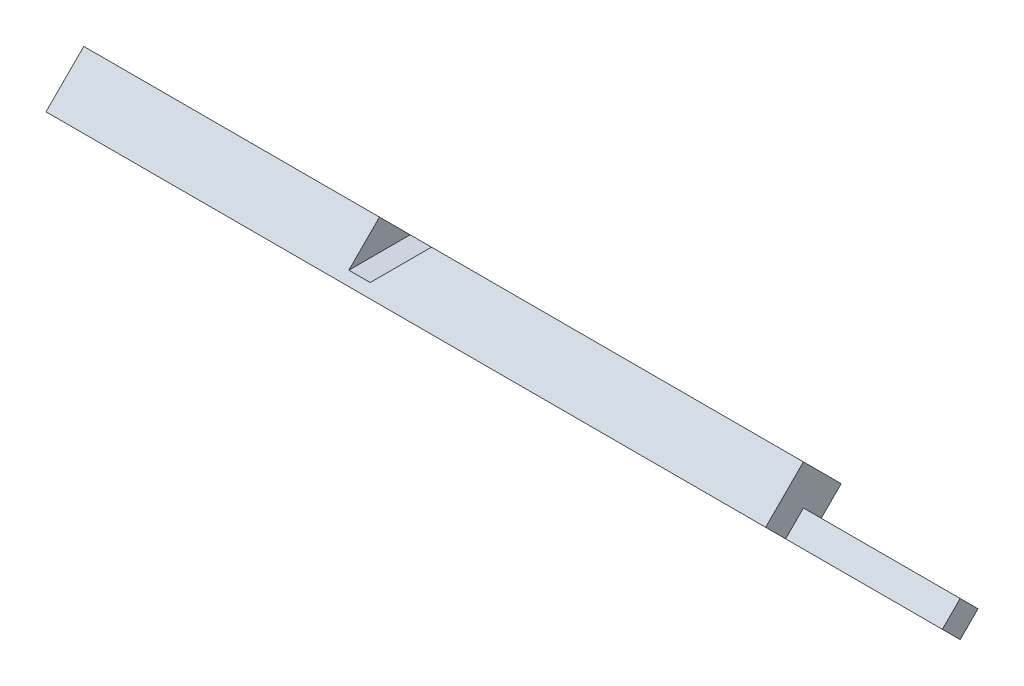
from build123d import *

# Parameters (mm, degrees)
BOSS_EXTRUDE1_DEPTH     = 101
BOSS_EXTRUDE2_DEPTH     = 22
CUT_EXTRUDE1_REACH      = 126.228
CUT_EXTRUDE1_START      = 1
SKETCH3_W               = 3
SKETCH3_H               = 10.606601718
CUT_EXTRUDE2_DEPTH      = 124.228446391
CUT_EXTRUDE2_DEPTH_BACK = 124.228446391


with BuildPart() as part:
    # Sketch1 → Boss-Extrude1 (new body)
    with BuildSketch(Plane(origin=(0, 0, 0), x_dir=(0, 0, -1), z_dir=(1, 0, 0))):
        Polygon((5.303300859, 0), (0, 5.303300859), (-5.303300859, 0), (0, -5.303300859), align=None)
    extrude(amount=BOSS_EXTRUDE1_DEPTH)

    # Sketch2 → Boss-Extrude2 (add)
    with BuildSketch(Plane(origin=(101, 0, 0), x_dir=(0, 0, -1), z_dir=(1, 0, 0))):
        Polygon((0, -5.303300859), (-2.5, -2.803300859), (0, -0.303300859), (2.5, -2.803300859), align=None)
    extrude(amount=BOSS_EXTRUDE2_DEPTH)

    # Sketch3 → Cut-Extrude1 (cut, up to next)
    with BuildSketch(Plane(origin=(0, 0, 0), x_dir=(1, 0, 0), z_dir=(0, 1, 0)).offset(CUT_EXTRUDE1_START), mode=Mode.PRIVATE) as cut_extrude1_sk1:
        with Locations((43, 0)):
            Rectangle(SKETCH3_W, SKETCH3_H)
    cut_extrude1_tool1 = extrude(cut_extrude1_sk1.sketch, amount=CUT_EXTRUDE1_REACH, mode=Mode.PRIVATE) & part.part
    add(cut_extrude1_tool1.solids().sort_by_distance((43, 1, 0))[0], mode=Mode.SUBTRACT)

    # Sketch4 → Cut-Extrude2 (cut, two sides: drawn at the far end of the back side and taken through both)
    with BuildSketch(Plane.XY.offset(-CUT_EXTRUDE2_DEPTH_BACK)):
        Polygon((44.5, 1), (48.803300859, 5.303300859), (44.5, 5.303300859), align=None)
    extrude(amount=CUT_EXTRUDE2_DEPTH + CUT_EXTRUDE2_DEPTH_BACK, mode=Mode.SUBTRACT)


solid = part.part
